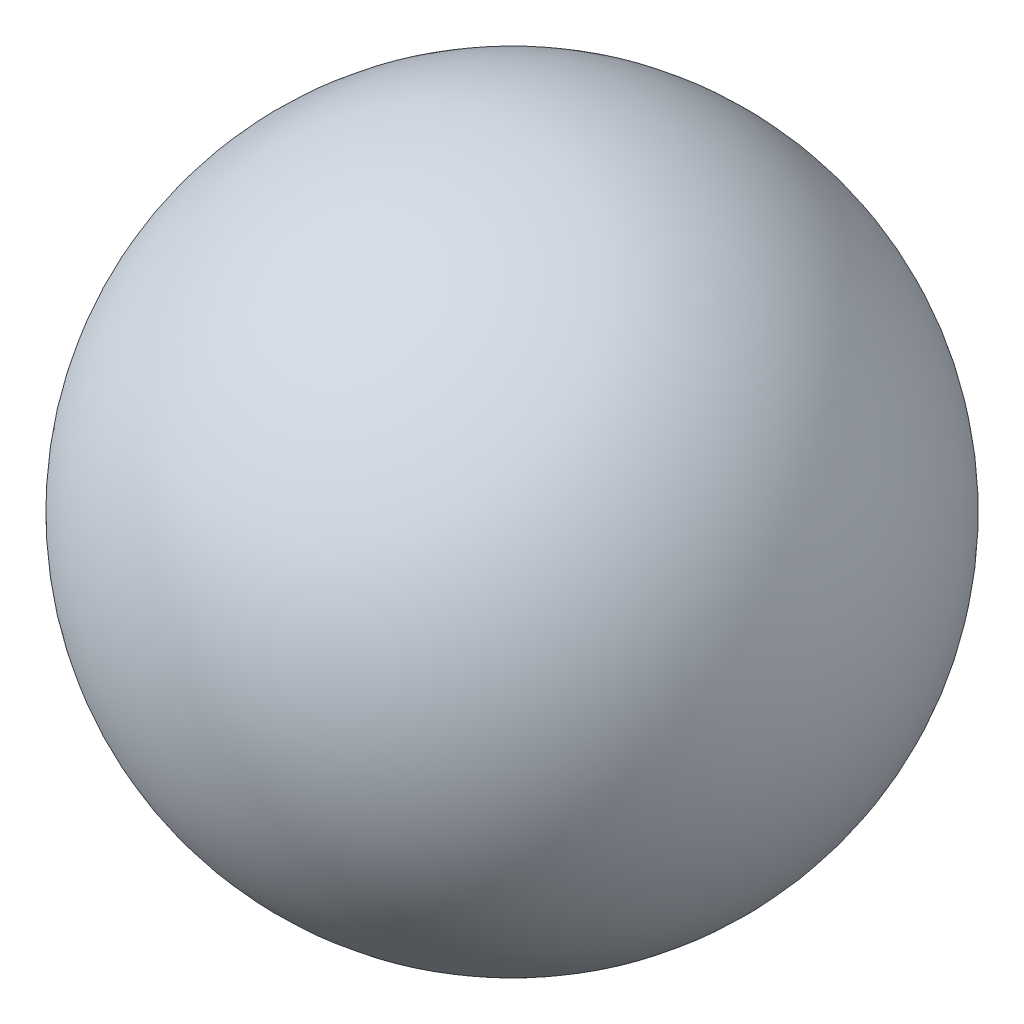
from build123d import *


with BuildPart() as part:
    # 草图1 → 旋转1 (revolve)
    with BuildSketch(Plane.XY):
        with BuildLine():
            Line((0, 115), (0, -115))
            ThreePointArc((0, -115), (-115, 0), (0, 115))
        make_face()
    revolve(axis=Axis((0, 115, 0), (0, -1, 0)))


solid = part.part
